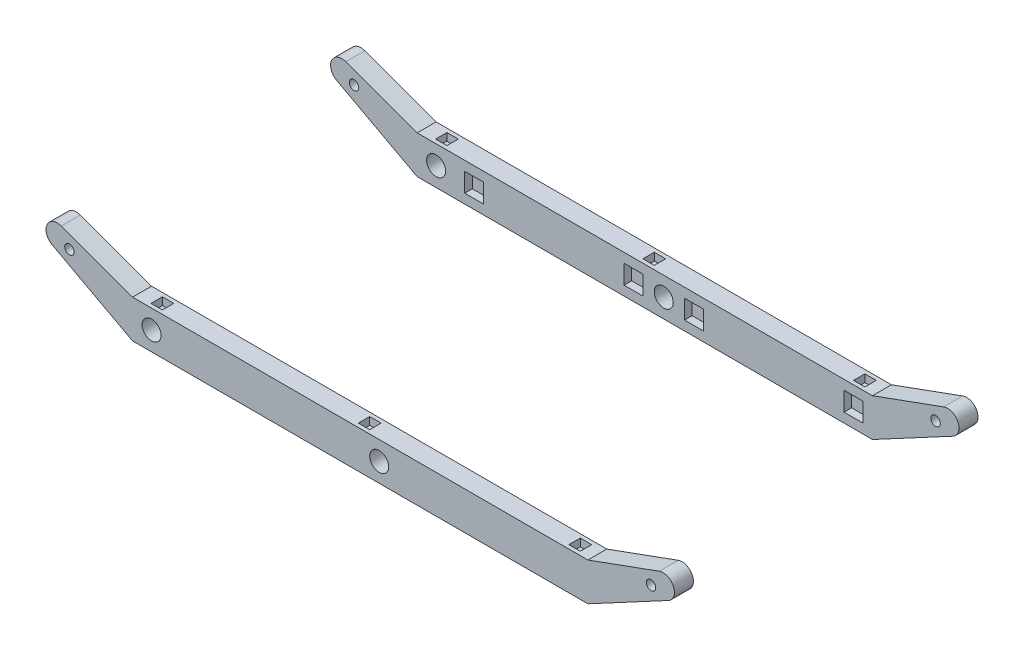
from build123d import *

# Parameters (mm, degrees)
BOSS_EXTRUDE3_DEPTH      = 600
BOSS_EXTRUDE3_DEPTH_BACK = 600
SKETCH1_W                = 50
SKETCH1_H                = 100
BOSS_EXTRUDE4_DEPTH      = 50
SKETCH4_R                = 25
SKETCH4_R_2              = 12.5
CUT_EXTRUDE1_DEPTH       = 839.37045622
SKETCH5_W                = 50
SKETCH5_H                = 50
CUT_EXTRUDE2_DEPTH       = 20
SKETCH7_W                = 30
SKETCH7_H                = 30
CUT_EXTRUDE3_DEPTH       = 20


with BuildPart() as part:
    # Sketch1 → Boss-Extrude3 (new, two sides: drawn at the far end of the back side and taken through both)
    with BuildSketch(Plane(origin=(0, 0, 0), x_dir=(0, 0, -1), z_dir=(1, 0, 0)).offset(-BOSS_EXTRUDE3_DEPTH_BACK)):
        Rectangle(SKETCH1_W, SKETCH1_H)
    extrude(amount=BOSS_EXTRUDE3_DEPTH + BOSS_EXTRUDE3_DEPTH_BACK)

    # Sketch3 → Boss-Extrude4 (add)
    with BuildSketch(Plane.XY.offset(25)):
        with BuildLine():
            Line((600, 50), (787.938524157, 118.404028665))
            ThreePointArc((787.938524157, 118.404028665), (825.586409015, 102.458120952), (812.365913421, 63.768927328))
            Line((812.365913421, 63.768927328), (600, -50))
            Line((600, -50), (600, 50))
        make_face()
    boss_extrude4 = extrude(amount=-BOSS_EXTRUDE4_DEPTH)

    # Mirror1: Boss-Extrude4 across plane
    add(boss_extrude4.mirror(Plane(origin=(0, 0, 0), x_dir=(0, 0, 1), z_dir=(1, 0, 0))))

    # Sketch4 → Cut-Extrude1 (cut, through all)
    with BuildSketch(Plane.XY.offset(25)):
        with Locations((-550, 0)):
            Circle(SKETCH4_R)
        with Locations((50, 0)):
            Circle(SKETCH4_R)
        with Locations((766.320606962, 75.79432784)):
            Circle(SKETCH4_R_2)
        with Locations((-766.320606962, 75.79432784)):
            Circle(SKETCH4_R_2)
    extrude(amount=-CUT_EXTRUDE1_DEPTH, mode=Mode.SUBTRACT)

    # Sketch5 → Cut-Extrude2 (cut)
    with BuildSketch(Plane(origin=(0, 0, -25), x_dir=(-1, 0, 0), z_dir=(0, 0, -1))):
        with Locations((449.657658347, 0)):
            Rectangle(SKETCH5_W, SKETCH5_H)
        with Locations((29.657658347, 0)):
            Rectangle(SKETCH5_W, SKETCH5_H)
        with Locations((-549.992341653, 0)):
            Rectangle(SKETCH5_W, SKETCH5_H)
        with Locations((-129.657658347, 0)):
            Rectangle(SKETCH5_W, SKETCH5_H)
    extrude(amount=-CUT_EXTRUDE2_DEPTH, mode=Mode.SUBTRACT)

    # Sketch7 → Cut-Extrude3 (cut)
    with BuildSketch(Plane(origin=(0, 50, 0), x_dir=(1, 0, 0), z_dir=(0, 1, 0))):
        with Locations((-546.5, 0)):
            Rectangle(SKETCH7_W, SKETCH7_H)
        Rectangle(SKETCH7_W, SKETCH7_H)
        with Locations((555, 0)):
            Rectangle(SKETCH7_W, SKETCH7_H)
    extrude(amount=-CUT_EXTRUDE3_DEPTH, mode=Mode.SUBTRACT)


with BuildPart() as body_2:
    # Mirror4: mirrored copy
    add(part.part.mirror(Plane(origin=(0, 0, -375), x_dir=(1, 0, 0), z_dir=(0, 0, -1))))


solid = Compound([part.part, body_2.part])
